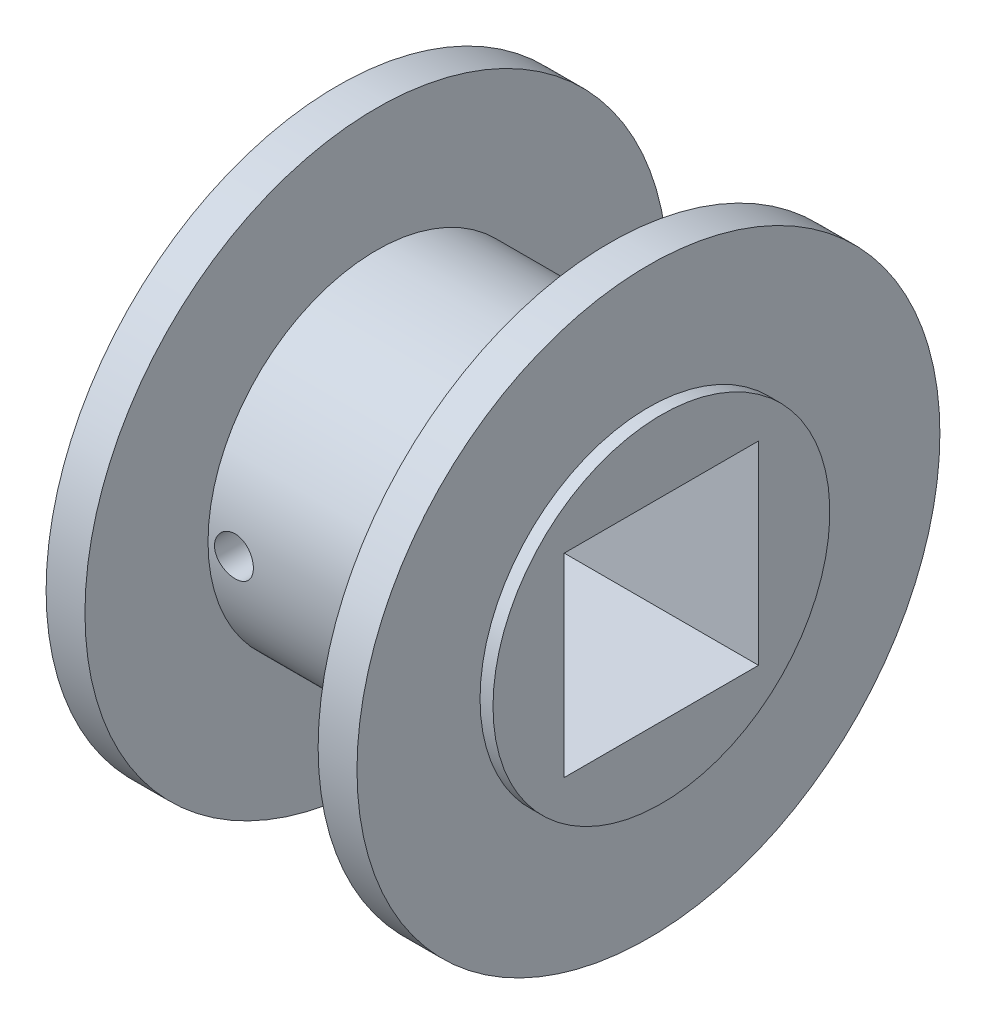
from build123d import *

# Parameters (mm, degrees)
CUT_EXTRUDE1_DEPTH = 42.091361623
SKETCH3_R          = 1.5
CUT_EXTRUDE2_DEPTH = 46.631677594


with BuildPart() as part:
    # Sketch1 → Revolve1 (revolve)
    with BuildSketch(Plane.XY, mode=Mode.PRIVATE) as revolve1_sk:
        Polygon((0, 7.5), (26, 7.5), (26, 13), (25, 13), (25, 22.5), (22, 22.5), (22, 13), (4, 13), (4, 22.5), (1, 22.5), (1, 13), (0, 13), align=None)
    revolve(revolve1_sk.sketch.rotate(Axis((0, 0, 0), (1, 0, 0)), 90), axis=Axis((0, 0, 0), (1, 0, 0)))

    # Sketch2 → Cut-Extrude1 (cut, through all)
    with BuildSketch(Plane(origin=(26, 0, 0), x_dir=(0, 0, -1), z_dir=(1, 0, 0))):
        with BuildLine():
            ThreePointArc((0, 7.5), (-2.870125743, 6.929096494), (-5.303300859, 5.303300859))
            Line((-5.303300859, 5.303300859), (5.303300859, -5.303300859))
            ThreePointArc((5.303300859, -5.303300859), (6.929096494, -2.870125743), (7.5, 0))
            ThreePointArc((7.5, 0), (5.303300859, 5.303300859), (0, 7.5))
        make_face()
        with BuildLine():
            Line((5.303300859, -5.303300859), (-5.303300859, 5.303300859))
            ThreePointArc((-5.303300859, 5.303300859), (-6.929096494, 2.870125743), (-7.5, 0))
            ThreePointArc((-7.5, 0), (-5.303300859, -5.303300859), (0, -7.5))
            ThreePointArc((0, -7.5), (2.870125743, -6.929096494), (5.303300859, -5.303300859))
        make_face()
        with BuildLine():
            Line((0, 7.5), (-7.5, 7.5))
            Line((-7.5, 7.5), (-5.303300859, 5.303300859))
            ThreePointArc((-5.303300859, 5.303300859), (-2.870125743, 6.929096494), (0, 7.5))
        make_face()
        with BuildLine():
            Line((7.5, 7.5), (0, 7.5))
            ThreePointArc((0, 7.5), (5.303300859, 5.303300859), (7.5, 0))
            Line((7.5, 0), (7.5, 7.5))
        make_face()
        with BuildLine():
            ThreePointArc((7.5, 0), (6.929096494, -2.870125743), (5.303300859, -5.303300859))
            Line((5.303300859, -5.303300859), (7.5, -7.5))
            Line((7.5, -7.5), (7.5, 0))
        make_face()
        with BuildLine():
            Line((7.5, -7.5), (5.303300859, -5.303300859))
            ThreePointArc((5.303300859, -5.303300859), (2.870125743, -6.929096494), (0, -7.5))
            Line((0, -7.5), (7.5, -7.5))
        make_face()
        with BuildLine():
            ThreePointArc((0, -7.5), (-5.303300859, -5.303300859), (-7.5, 0))
            Line((-7.5, 0), (-7.5, -7.5))
            Line((-7.5, -7.5), (0, -7.5))
        make_face()
        with BuildLine():
            Line((-5.303300859, 5.303300859), (-7.5, 7.5))
            Line((-7.5, 7.5), (-7.5, 0))
            ThreePointArc((-7.5, 0), (-6.929096494, 2.870125743), (-5.303300859, 5.303300859))
        make_face()
    extrude(amount=-CUT_EXTRUDE1_DEPTH, mode=Mode.SUBTRACT)

    # Sketch3 → Cut-Extrude2 (cut, through all)
    with BuildSketch(Plane(origin=(0, 0, 7.5), x_dir=(-1, 0, 0), z_dir=(0, 0, -1))):
        with Locations(Location((-6, 0, 0), (0, 0, 90))):
            Circle(SKETCH3_R)
    extrude(amount=-CUT_EXTRUDE2_DEPTH, mode=Mode.SUBTRACT)


solid = part.part
